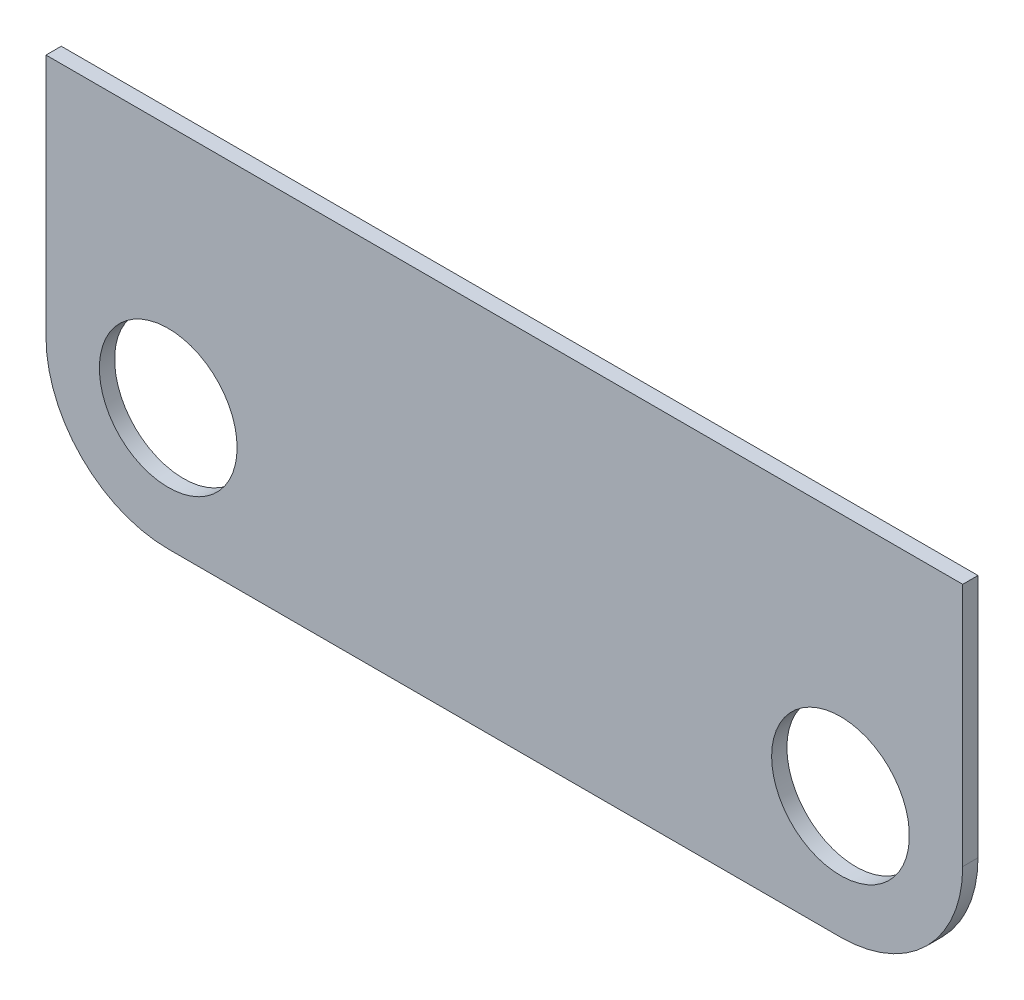
from build123d import *

# Parameters (mm, degrees)
SKETCH1_R           = 14.3129
BOSS_EXTRUDE1_DEPTH = 3.175


with BuildPart() as part:
    # Sketch1 → Boss-Extrude1 (new body)
    with BuildSketch(Plane.XY):
        with BuildLine():
            Line((69.85, -38.1), (-69.85, -38.1))
            ThreePointArc((-69.85, -38.1), (-87.810512242, -30.660512242), (-95.25, -12.7))
            Line((-95.25, -12.7), (-95.25, 38.1))
            Line((-95.25, 38.1), (95.25, 38.1))
            Line((95.25, 38.1), (95.25, -12.7))
            ThreePointArc((95.25, -12.7), (87.810512242, -30.660512242), (69.85, -38.1))
        make_face()
        with Locations((-69.85, -12.7)):
            Circle(SKETCH1_R, mode=Mode.SUBTRACT)
        with Locations(Location((69.85, -12.7, 0), (0, 0, 180))):
            Circle(SKETCH1_R, mode=Mode.SUBTRACT)
    extrude(amount=BOSS_EXTRUDE1_DEPTH)


solid = part.part
